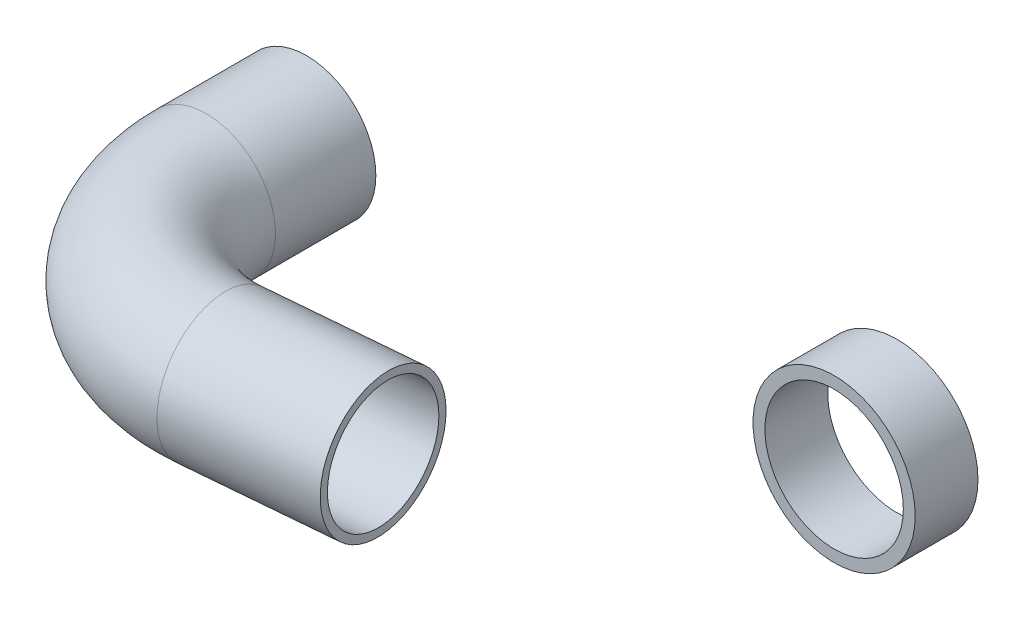
from build123d import *

# Parameters (mm, degrees)
SKETCH1_R           = 20.5
SKETCH1_R_2         = 17.5
BOSS_EXTRUDE1_DEPTH = 15.875
SKETCH4_R           = 17.5
SKETCH4_R_2         = 15.5


with BuildPart() as part:
    # Sketch1 → Boss-Extrude1 (new body)
    with BuildSketch(Plane.XY):
        Circle(SKETCH1_R)
        Circle(SKETCH1_R_2, mode=Mode.SUBTRACT)
    extrude(amount=BOSS_EXTRUDE1_DEPTH)


with BuildPart() as body_2:
    # Sweep1: sweep along a path in Sketch5
    with BuildLine(Plane(origin=(0, 0, 0), x_dir=(1, 0, 0), z_dir=(0, 1, 0))) as sweep1_path:
        Line((-60.324348204, -69.559384199), (-98.279366201, -72.880017997))
        ThreePointArc((-98.279366201, -72.880017997), (-127.33998691, -63.015266532), (-139.7, -34.925))
        Line((-139.7, -34.925), (-139.7, -9.525))
    # Sketch4 → Sweep1 (sweep)
    with BuildSketch(Plane.XY.offset(9.525)):
        with Locations((-139.7, 0)):
            Circle(SKETCH4_R)
        with Locations((-139.7, 0)):
            Circle(SKETCH4_R_2, mode=Mode.SUBTRACT)
    sweep(path=sweep1_path.line)


solid = Compound([part.part, body_2.part])
